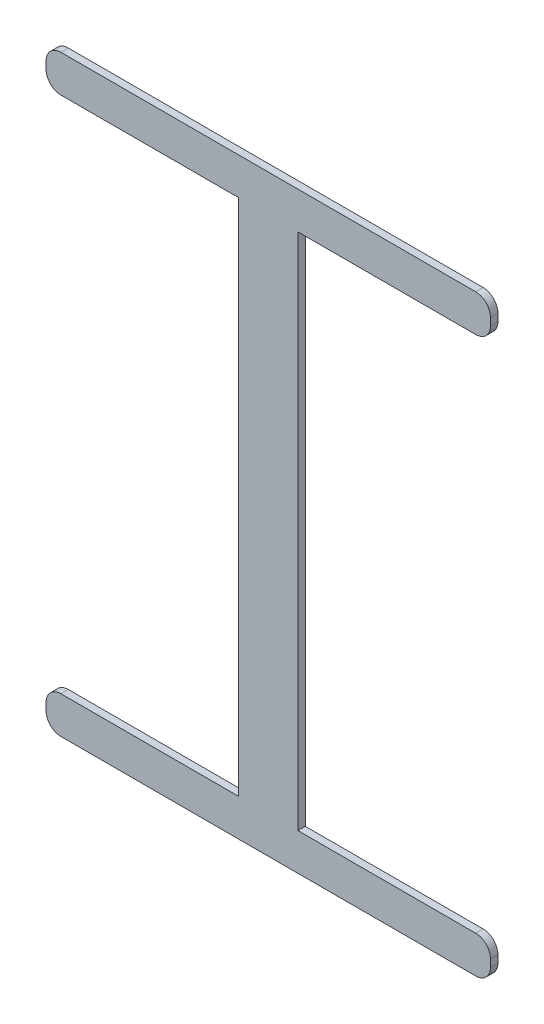
from build123d import *

# Parameters (mm, degrees)
EXTRUDE_1_DEPTH = 2


with BuildPart() as part:
    # 草图1 → 凸台-拉伸1 (new body)
    with BuildSketch(Plane.XY):
        with BuildLine():
            Line((-56, 80), (56, 80))
            ThreePointArc((56, 80), (58.828427125, 78.828427125), (60, 76))
            Line((60, 76), (60, 74))
            ThreePointArc((60, 74), (58.828427125, 71.171572875), (56, 70))
            Line((56, 70), (8, 70))
            Line((8, 70), (8, -70))
            Line((8, -70), (56, -70))
            ThreePointArc((56, -70), (58.828427125, -71.171572875), (60, -74))
            Line((60, -74), (60, -76))
            ThreePointArc((60, -76), (58.828427125, -78.828427125), (56, -80))
            Line((56, -80), (-56, -80))
            ThreePointArc((-56, -80), (-58.828427125, -78.828427125), (-60, -76))
            Line((-60, -76), (-60, -74))
            ThreePointArc((-60, -74), (-58.828427125, -71.171572875), (-56, -70))
            Line((-56, -70), (-8, -70))
            Line((-8, -70), (-8, 70))
            Line((-8, 70), (-56, 70))
            ThreePointArc((-56, 70), (-58.828427125, 71.171572875), (-60, 74))
            Line((-60, 74), (-60, 76))
            ThreePointArc((-60, 76), (-58.828427125, 78.828427125), (-56, 80))
        make_face()
    extrude(amount=EXTRUDE_1_DEPTH)


solid = part.part
